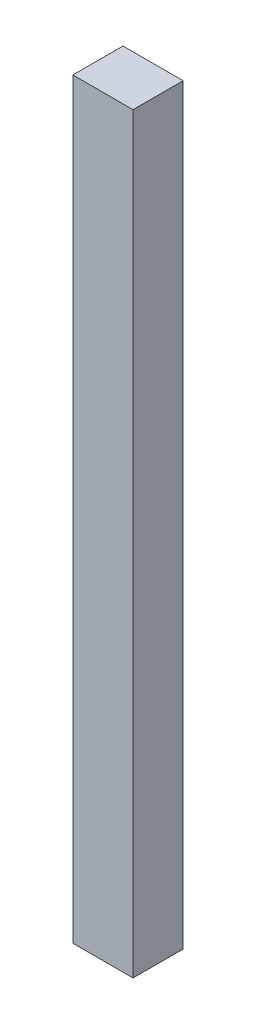
from build123d import *

# Parameters (mm, degrees)
SKETCH1_W           = 3.048
SKETCH1_H           = 2.54
BOSS_EXTRUDE1_DEPTH = 38.1


with BuildPart() as part:
    # Sketch1 → Boss-Extrude1 (new body)
    with BuildSketch(Plane(origin=(0, 0, 0), x_dir=(1, 0, 0), z_dir=(0, 1, 0))):
        Rectangle(SKETCH1_W, SKETCH1_H)
    extrude(amount=BOSS_EXTRUDE1_DEPTH)


solid = part.part
